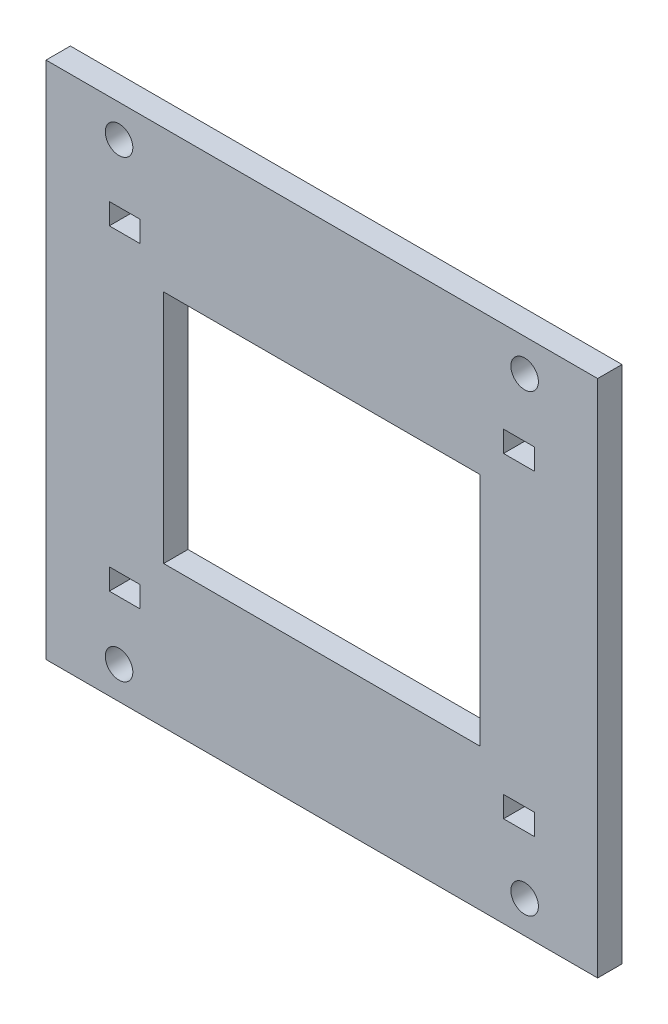
from build123d import *

# Parameters (mm, degrees)
SKETCH_1_W                         = 68
SKETCH_1_H                         = 64
BOARD_MOUNT_BASE_DEPTH             = 3
SOLDER_AND_CONNECTOR_OPENING_START = -0.1
SKETCH_2_W                         = 39
SKETCH_2_H                         = 29
SOLDER_AND_CONNECTOR_OPENING_DEPTH = 3.2
PCB_M2_SLOTS_CENTRES48P6X39_START  = -0.1
SKETCH_3_W                         = 3.8
SKETCH_3_H                         = 2.6
PCB_M2_SLOTS_CENTRES48P6X39_DEPTH  = 3.2
DECK_ATTACHMENT_M3_START           = -0.1
SKETCH_4_R                         = 1.7
DECK_ATTACHMENT_M3_DEPTH           = 3.2


with BuildPart() as part:
    # 草图1 → Board_mount_base (new body)
    with BuildSketch(Plane.XY):
        Rectangle(SKETCH_1_W, SKETCH_1_H)
    extrude(amount=BOARD_MOUNT_BASE_DEPTH)

    # 草图2 → Solder_and_connector_opening (cut)
    with BuildSketch(Plane.XY.offset(SOLDER_AND_CONNECTOR_OPENING_START)):
        Rectangle(SKETCH_2_W, SKETCH_2_H)
    extrude(amount=SOLDER_AND_CONNECTOR_OPENING_DEPTH, mode=Mode.SUBTRACT)

    # 草图3 → PCB_M2_slots_centres48p6x39 (cut)
    with BuildSketch(Plane.XY.offset(PCB_M2_SLOTS_CENTRES48P6X39_START)):
        with Locations((-24.3, -19.5)):
            Rectangle(SKETCH_3_W, SKETCH_3_H)
        with Locations((-24.3, 19.5)):
            Rectangle(SKETCH_3_W, SKETCH_3_H)
        with Locations((24.3, -19.5)):
            Rectangle(SKETCH_3_W, SKETCH_3_H)
        with Locations((24.3, 19.5)):
            Rectangle(SKETCH_3_W, SKETCH_3_H)
    extrude(amount=PCB_M2_SLOTS_CENTRES48P6X39_DEPTH, mode=Mode.SUBTRACT)

    # 草图4 → Deck_attachment_M3 (cut)
    with BuildSketch(Plane.XY.offset(DECK_ATTACHMENT_M3_START)):
        with Locations((-25, -28)):
            Circle(SKETCH_4_R)
        with Locations((-25, 28)):
            Circle(SKETCH_4_R)
        with Locations((25, -28)):
            Circle(SKETCH_4_R)
        with Locations((25, 28)):
            Circle(SKETCH_4_R)
    extrude(amount=DECK_ATTACHMENT_M3_DEPTH, mode=Mode.SUBTRACT)


solid = part.part
